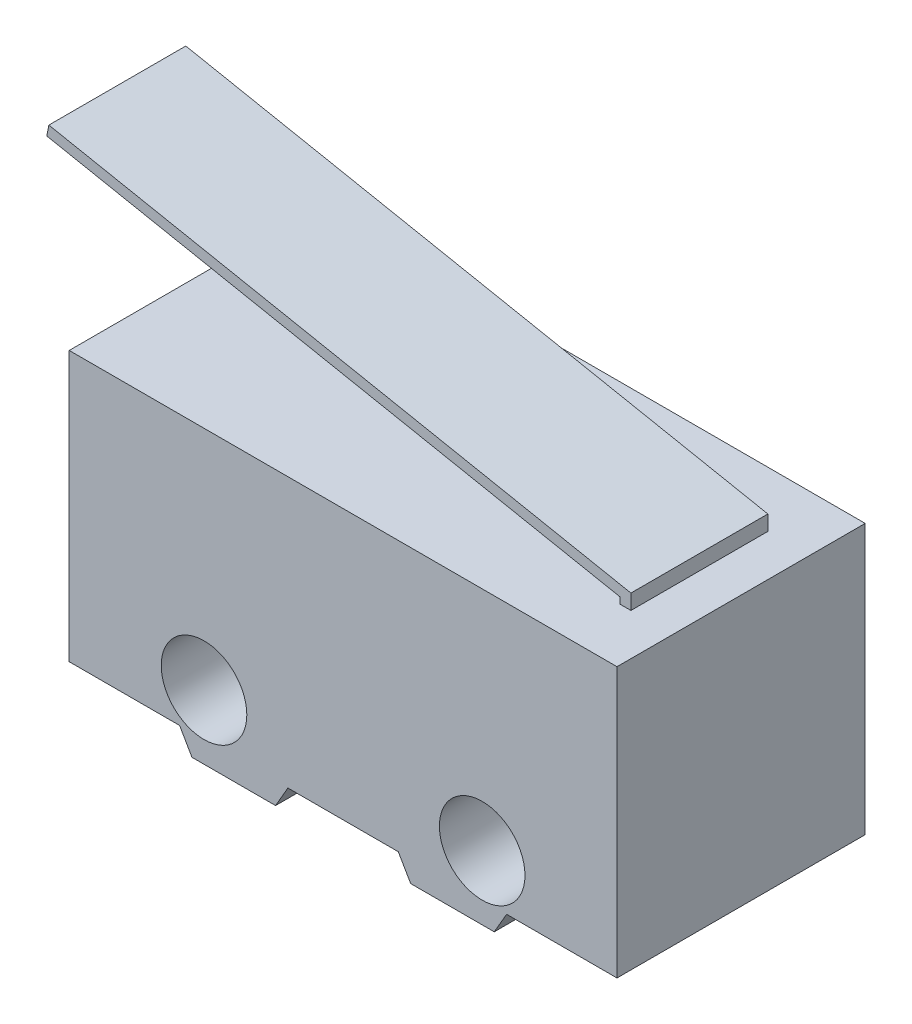
from build123d import *

# Parameters (mm, degrees)
SKETCH1_W           = 12.8
SKETCH1_H           = 6.3
BOSS_EXTRUDE1_DEPTH = 2.9
BOSS_EXTRUDE3_DEPTH = 5.8
SKETCH2_3_R         = 1
CUT_EXTRUDE2_DEPTH  = 10.376699846
EXTRUDE_THIN1_DEPTH = 1.6


with BuildPart() as part:
    # Sketch1 → Boss-Extrude1 (new, symmetric)
    with BuildSketch(Plane.XY):
        Rectangle(SKETCH1_W, SKETCH1_H)
    extrude(amount=BOSS_EXTRUDE1_DEPTH, both=True)

    # Sketch2 → Boss-Extrude3 (add, through all)
    with BuildSketch(Plane.XY.offset(2.9)):
        Polygon((-4.508746523, -1.958141571), (-3.531951604, -0.266283143), (-1.578361765, -0.266283143), (-0.601566846, -1.958141571), (-1.578361765, -3.65), (-3.531951604, -3.65), align=None)
        Polygon((3.531951604, -0.266283143), (1.578361765, -0.266283143), (0.601566846, -1.958141571), (1.578361765, -3.65), (3.531951604, -3.65), (4.508746523, -1.958141571), align=None)
    extrude(amount=-BOSS_EXTRUDE3_DEPTH)

    # Sketch2<3> → Cut-Extrude2 (cut, through all)
    with BuildSketch(Plane.XY.offset(2.9)):
        with Locations((3.25, -2.15)):
            Circle(SKETCH2_3_R)
        with Locations((-3.25, -2.15)):
            Circle(SKETCH2_3_R)
    extrude(amount=-CUT_EXTRUDE2_DEPTH, mode=Mode.SUBTRACT)

    # Sketch3 → Extrude-Thin1 (add, symmetric)
    with BuildSketch(Plane.XY):
        Polygon((5.425, 3.15), (5.425, 3.502848465), (-8.175922459, 6.17265917), (-8.224077541, 5.92734083), (5.175, 3.297151535), (5.175, 3.15), align=None)
    extrude(amount=EXTRUDE_THIN1_DEPTH, both=True)


solid = part.part
